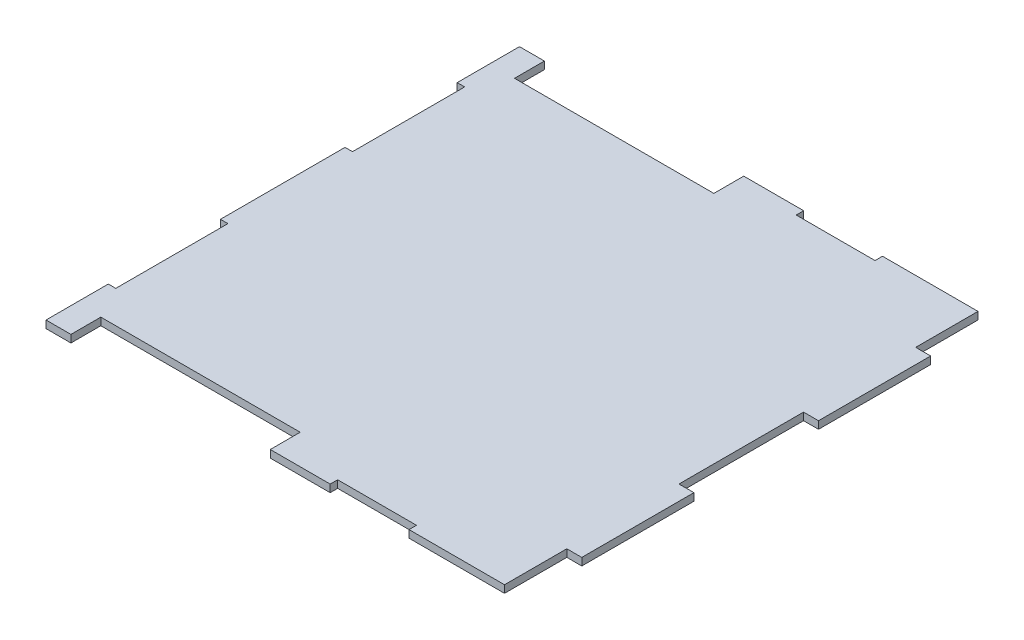
from build123d import *

# Parameters (mm, degrees)
SKETCH1_W               = 190
SKETCH1_H               = 190
BOSS_EXTRUDE1_DEPTH     = 3
CUT_EXTRUDE2_DEPTH      = 135.383778783
CUT_EXTRUDE2_DEPTH_BACK = 3
SKETCH2_OUTSIDE_W       = 245.744
SKETCH2_OUTSIDE_H       = 245.744
SKETCH4_W               = 80
SKETCH4_H               = 12
CUT_EXTRUDE4_DEPTH      = 3
CUT_EXTRUDE5_DEPTH      = 3


with BuildPart() as part:
    # Sketch1 → Boss-Extrude1 (new body)
    with BuildSketch(Plane(origin=(0, 0, 0), x_dir=(1, 0, 0), z_dir=(0, 1, 0))):
        Rectangle(SKETCH1_W, SKETCH1_H)
    extrude(amount=BOSS_EXTRUDE1_DEPTH)

    # Sketch2 outside → Cut-Extrude2 (cut, two sides: drawn at the far end of the back side and taken through both)
    with BuildSketch(Plane(origin=(0, 3, 0), x_dir=(1, 0, 0), z_dir=(0, 1, 0)).offset(-CUT_EXTRUDE2_DEPTH_BACK)):
        Rectangle(SKETCH2_OUTSIDE_W, SKETCH2_OUTSIDE_H)
        Polygon((-95, -95), (-95, -70), (-92, -70), (-92, -25), (-95, -25), (-95, 25), (-92, 25), (-92, 70), (-95, 70), (-95, 95), (89, 95), (89, 70), (95, 70), (95, 25), (89, 25), (89, -25), (95, -25), (95, -70), (89, -70), (89, -95), align=None, mode=Mode.SUBTRACT)
    extrude(amount=CUT_EXTRUDE2_DEPTH + CUT_EXTRUDE2_DEPTH_BACK, mode=Mode.SUBTRACT)

    # Sketch4 → Cut-Extrude4 (cut)
    with BuildSketch(Plane(origin=(0, 3, 0), x_dir=(1, 0, 0), z_dir=(0, 1, 0))):
        with Locations((-45, 89)):
            Rectangle(SKETCH4_W, SKETCH4_H)
        with Locations((-45, -89)):
            Rectangle(SKETCH4_W, SKETCH4_H)
    extrude(amount=-CUT_EXTRUDE4_DEPTH, mode=Mode.SUBTRACT)

    # Sketch5 → Cut-Extrude5 (cut)
    with BuildSketch(Plane.XY.offset(95)):
        Polygon((50.678414624, 3), (50.692948093, 0), (19.039732141, 0), (19.039732141, 3), align=None)
    cut_extrude5 = extrude(amount=-CUT_EXTRUDE5_DEPTH, mode=Mode.SUBTRACT)

    # Mirror1: Cut-Extrude5 across plane
    add(cut_extrude5.mirror(Plane.XY), mode=Mode.SUBTRACT)


solid = part.part
